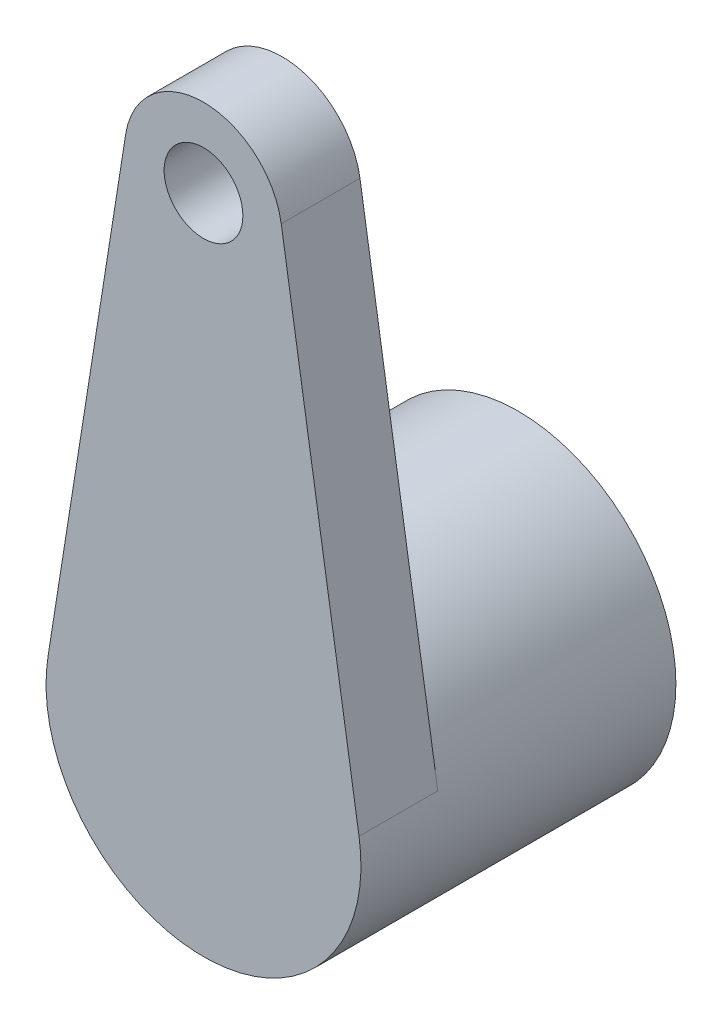
from build123d import *
from build123d.topology import SkipClean

# Parameters (mm, degrees)
SKETCH1_R           = 3.175
SKETCH1_R_2         = 1.5875
BOSS_EXTRUDE1_DEPTH = 4.7625
SKETCH2_R           = 0.79375
BOSS_EXTRUDE2_DEPTH = 1.5875


with BuildPart() as part:
    # Sketch1 → Boss-Extrude1 (new body)
    with BuildSketch(Plane.XY):
        with Locations(Location((14.60119787, -1.564197578, 0), (0, 0, 180))):
            Circle(SKETCH1_R)
        with Locations(Location((14.60119787, -1.564197578, 0), (0, 0, 180))):
            Circle(SKETCH1_R_2, mode=Mode.SUBTRACT)
    extrude(amount=BOSS_EXTRUDE1_DEPTH)

    # Sketch2 → Boss-Extrude2 (add)
    with SkipClean():  # the faces are left unmerged after this step: merging them gives an invalid solid
        with BuildSketch(Plane.XY.offset(4.7625)):
            with BuildLine():
                Line((11.465194702, -1.068103704), (13.033196686, 8.843849359))
                ThreePointArc((13.033196686, 8.843849359), (14.60119833, 10.183302422), (16.169199873, 8.843849241))
                Line((16.169199873, 8.843849241), (17.737201077, -1.068103951))
                ThreePointArc((17.737201077, -1.068103951), (14.601197744, -4.739197578), (11.465194702, -1.068103704))
            make_face()
            with Locations((14.60119827, 8.595802422)):
                Circle(SKETCH2_R, mode=Mode.SUBTRACT)
        extrude(amount=BOSS_EXTRUDE2_DEPTH)


solid = part.part
